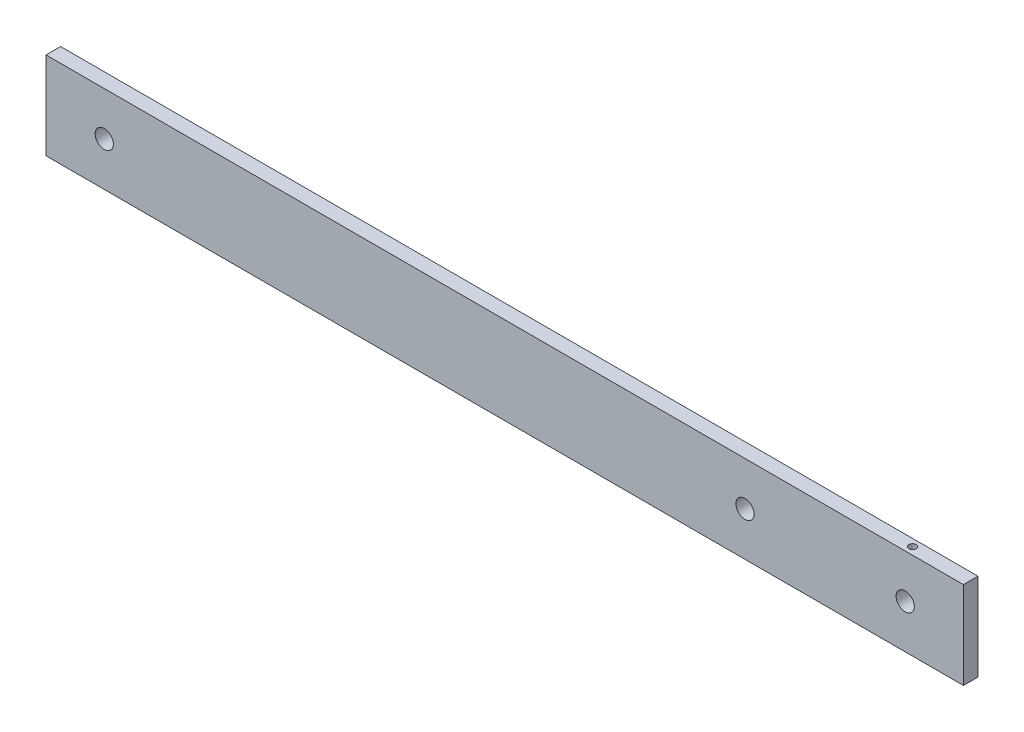
from build123d import *

# Parameters (mm, degrees)
SKETCH1_W               = 800.1
SKETCH1_H               = 76.2
BOSS_EXTRUDE1_DEPTH     = 12.7
CUT_EXTRUDE1_DEPTH      = 611.921484317
CUT_EXTRUDE1_DEPTH_BACK = 611.921484317
SKETCH2_R               = 7.9375
CUT_EXTRUDE2_DEPTH      = 615.475296493
CUT_EXTRUDE2_DEPTH_BACK = 31.75
SKETCH3_R               = 3.175


with BuildPart() as part:
    # Sketch1 → Boss-Extrude1 (new body)
    with BuildSketch(Plane.XY):
        with Locations((-209.55, 0)):
            Rectangle(SKETCH1_W, SKETCH1_H)
    extrude(amount=BOSS_EXTRUDE1_DEPTH)

    # Sketch2 → Cut-Extrude1 (cut, two sides: drawn at the far end of the back side and taken through both)
    with BuildSketch(Plane.XY.offset(12.7).offset(-CUT_EXTRUDE1_DEPTH_BACK)):
        Circle(SKETCH2_R)
        with Locations((-558.8, 0)):
            Circle(SKETCH2_R)
        with Locations((139.7, 0)):
            Circle(SKETCH2_R)
    extrude(amount=CUT_EXTRUDE1_DEPTH + CUT_EXTRUDE1_DEPTH_BACK, mode=Mode.SUBTRACT)

    # Sketch3 → Cut-Extrude2 (cut, two sides: drawn at the far end of the back side and taken through both)
    with BuildSketch(Plane(origin=(0, 38.1, 0), x_dir=(1, 0, 0), z_dir=(0, 1, 0)).offset(-CUT_EXTRUDE2_DEPTH_BACK)):
        with Locations(Location((139.7, -6.212362636, 0), (0, 0, 90))):
            Circle(SKETCH3_R)
    extrude(amount=CUT_EXTRUDE2_DEPTH + CUT_EXTRUDE2_DEPTH_BACK, mode=Mode.SUBTRACT)


solid = part.part
